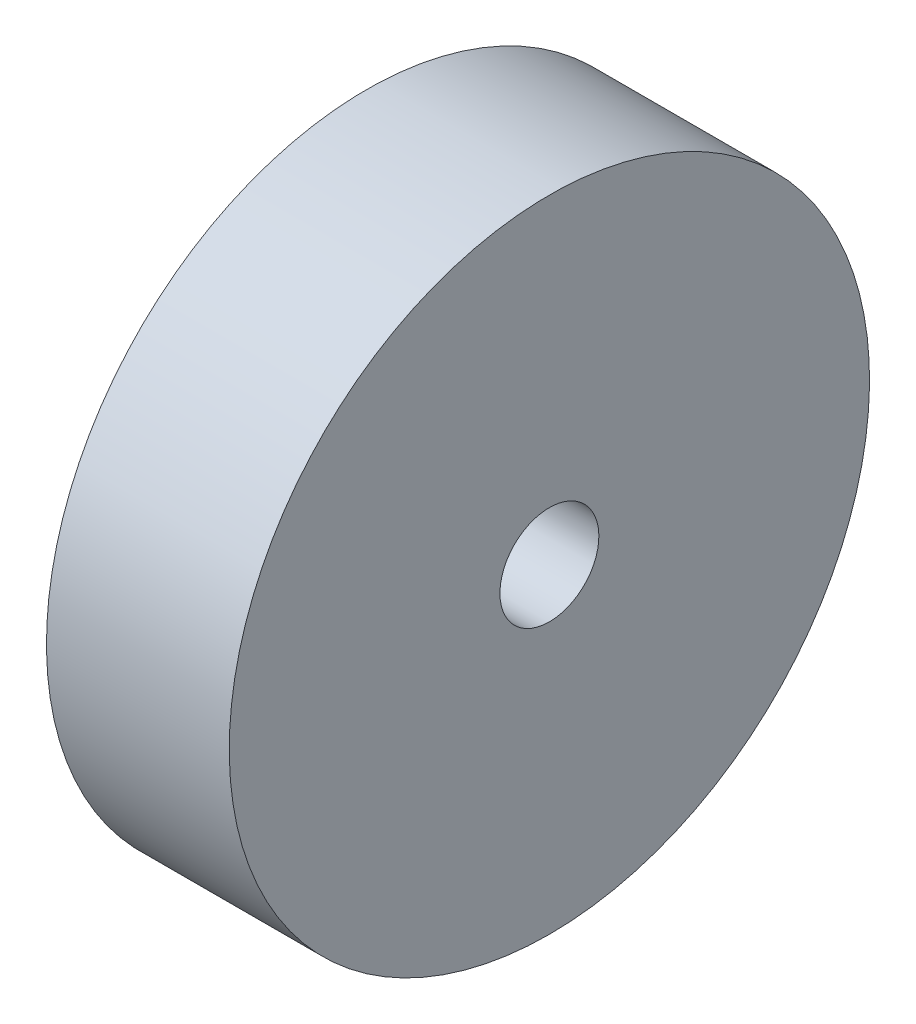
from build123d import *

# Parameters (mm, degrees)
SKETCH1_W = 1.57
SKETCH1_H = 2.325


with BuildPart() as part:
    # Sketch1 → Revolve1 (revolve)
    with BuildSketch(Plane.XY, mode=Mode.PRIVATE) as revolve1_sk:
        with Locations((0, 1.5875)):
            Rectangle(SKETCH1_W, SKETCH1_H)
    revolve(revolve1_sk.sketch.rotate(Axis((-0.785, 0, 0), (1, 0, 0)), 180), axis=Axis((-0.785, 0, 0), (1, 0, 0)))


solid = part.part
